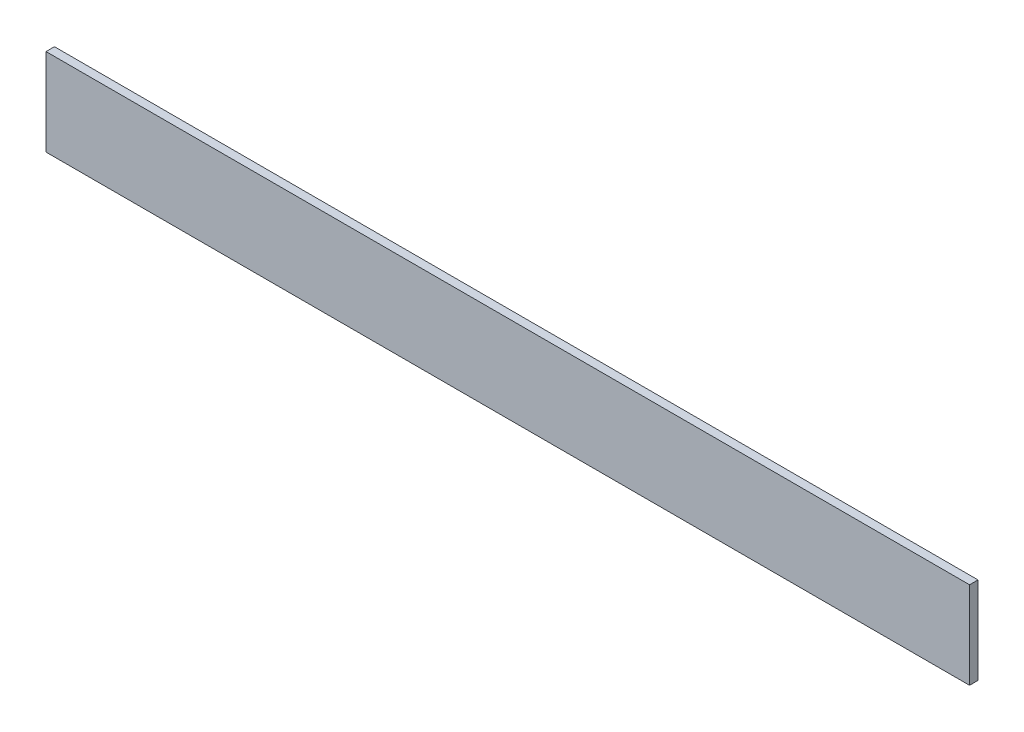
from build123d import *

# Parameters (mm, degrees)
SKETCH1_W           = 175
SKETCH1_H           = 16.5
BOSS_EXTRUDE1_DEPTH = 0.8


with BuildPart() as part:
    # Sketch1 → Boss-Extrude1 (new, symmetric)
    with BuildSketch(Plane.XY):
        Rectangle(SKETCH1_W, SKETCH1_H)
    extrude(amount=BOSS_EXTRUDE1_DEPTH, both=True)


solid = part.part
